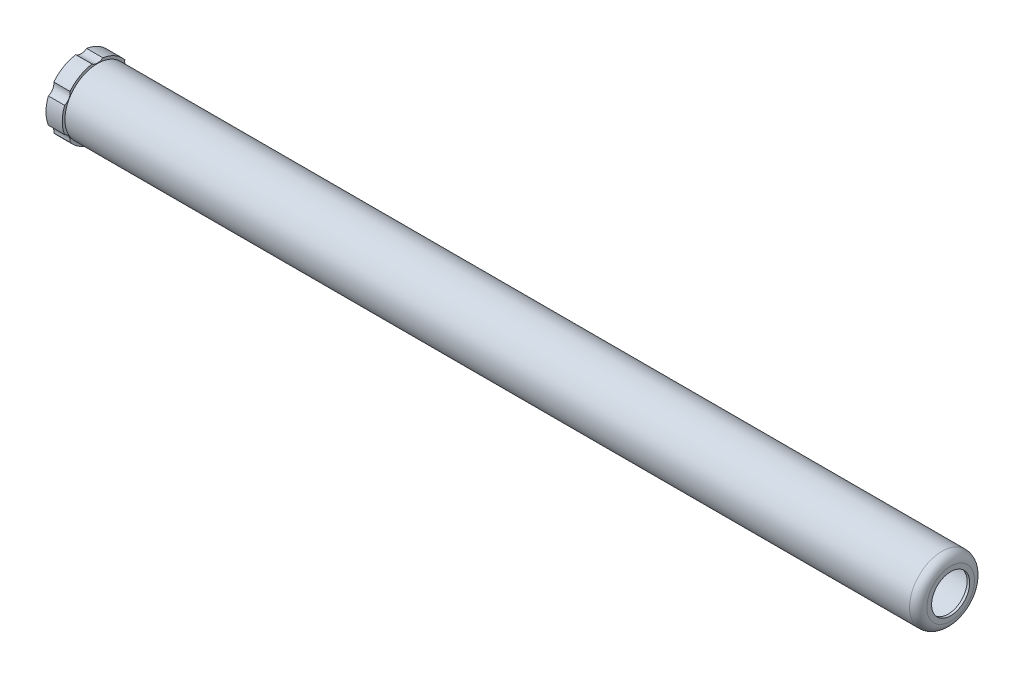
from build123d import *

# Parameters (mm, degrees)
SKETCH2_R               = 20.6375
SKETCH2_R_2             = 15.875
BOSS_EXTRUDE1_DEPTH     = 9.525
CUT_EXTRUDE1_DEPTH      = 511.993168343
CUT_EXTRUDE1_DEPTH_BACK = 511.993168343


with BuildPart() as part:
    # Sketch1 → Revolve1 (revolve)
    with BuildSketch(Plane.XY, mode=Mode.PRIVATE) as revolve1_sk:
        with BuildLine():
            Line((-5.08, 17.526), (-500.634, 17.526))
            Line((-500.634, 17.526), (-500.634, 19.05))
            Line((-500.634, 19.05), (-5.08, 19.05))
            ThreePointArc((-5.08, 19.05), (-1.487897552, 17.562102448), (0, 13.97))
            Line((0, 13.97), (0, 11.176))
            Line((0, 11.176), (-1.524, 11.176))
            Line((-1.524, 11.176), (-1.524, 13.97))
            ThreePointArc((-1.524, 13.97), (-2.565528286, 16.484471714), (-5.08, 17.526))
        make_face()
    revolve(revolve1_sk.sketch.rotate(Axis((-484.828271433, 0, 0), (1, 0, 0)), 90), axis=Axis((-484.828271433, 0, 0), (1, 0, 0)))

    # Sketch2 → Boss-Extrude1 (add)
    with BuildSketch(Plane.ZY.offset(500.634)):
        with Locations(Location((0, 0, 0), (0, 0, 180))):
            Circle(SKETCH2_R)
        with Locations(Location((0, 0, 0), (0, 0, 180))):
            Circle(SKETCH2_R_2, mode=Mode.SUBTRACT)
    extrude(amount=BOSS_EXTRUDE1_DEPTH)

    # Sketch4 → Cut-Extrude1 (cut, two sides: drawn at the far end of the back side and taken through both)
    with BuildSketch(Plane.ZY.offset(510.159).offset(-CUT_EXTRUDE1_DEPTH_BACK)):
        with BuildLine():
            ThreePointArc((3.175, 20.391806719), (0, 20.6375), (-3.175, 20.391806719))
            ThreePointArc((-3.175, 20.391806719), (0, 19.277380448), (3.175, 20.391806719))
        make_face()
        with BuildLine():
            ThreePointArc((19.247322647, 7.446272702), (17.872599271, 10.31875), (16.072322647, 12.945534016))
            ThreePointArc((16.072322647, 12.945534016), (16.694701186, 9.638690224), (19.247322647, 7.446272702))
        make_face()
        with BuildLine():
            ThreePointArc((16.072322647, -12.945534016), (17.872599271, -10.31875), (19.247322647, -7.446272702))
            ThreePointArc((19.247322647, -7.446272702), (16.694701186, -9.638690224), (16.072322647, -12.945534016))
        make_face()
        with BuildLine():
            ThreePointArc((-3.175, -20.391806719), (0, -20.6375), (3.175, -20.391806719))
            ThreePointArc((3.175, -20.391806719), (0, -19.277380448), (-3.175, -20.391806719))
        make_face()
        with BuildLine():
            ThreePointArc((-19.247322647, -7.446272702), (-17.872599271, -10.31875), (-16.072322647, -12.945534016))
            ThreePointArc((-16.072322647, -12.945534016), (-16.694701186, -9.638690224), (-19.247322647, -7.446272702))
        make_face()
        with BuildLine():
            ThreePointArc((-16.072322647, 12.945534016), (-17.872599271, 10.31875), (-19.247322647, 7.446272702))
            ThreePointArc((-19.247322647, 7.446272702), (-16.694701186, 9.638690224), (-16.072322647, 12.945534016))
        make_face()
    extrude(amount=CUT_EXTRUDE1_DEPTH + CUT_EXTRUDE1_DEPTH_BACK, mode=Mode.SUBTRACT)


solid = part.part
